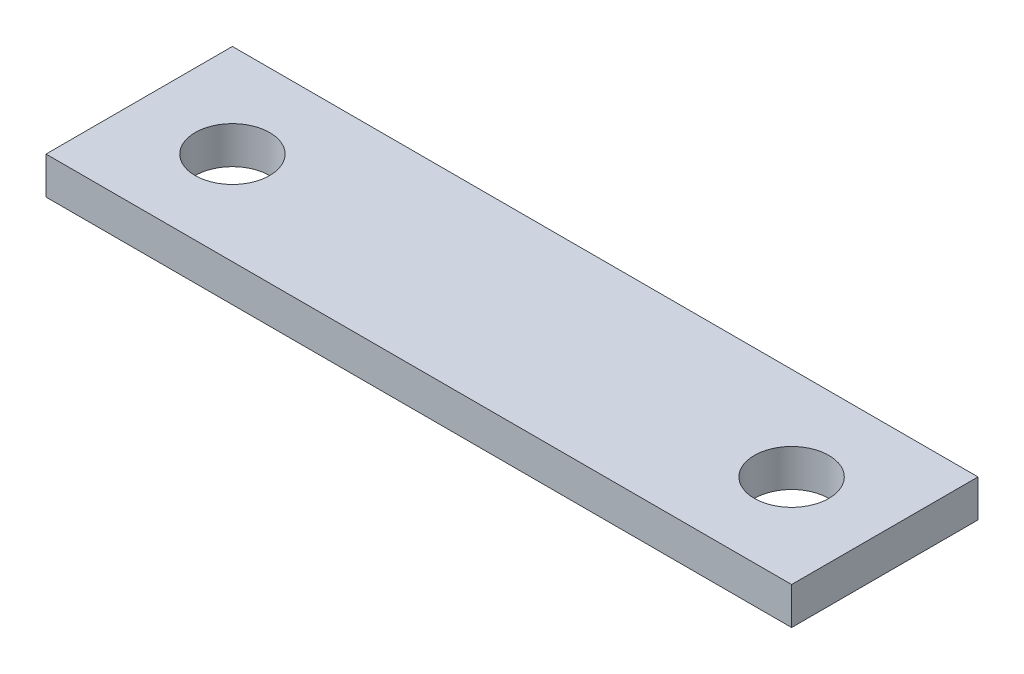
from build123d import *

# Parameters (mm, degrees)
SKETCH_1_W      = 120
SKETCH_1_H      = 30
SKETCH_1_R      = 6
EXTRUDE_1_DEPTH = 6


with BuildPart() as part:
    # 草图1 → 凸台-拉伸1 (new body)
    with BuildSketch(Plane(origin=(0, 0, 0), x_dir=(1, 0, 0), z_dir=(0, 1, 0))):
        with Locations((60, 15)):
            Rectangle(SKETCH_1_W, SKETCH_1_H)
        with Locations(Location((15, 15, 0), (0, 0, 270))):
            Circle(SKETCH_1_R, mode=Mode.SUBTRACT)
        with Locations(Location((105, 15, 0), (0, 0, 270))):
            Circle(SKETCH_1_R, mode=Mode.SUBTRACT)
    extrude(amount=EXTRUDE_1_DEPTH)


solid = part.part
